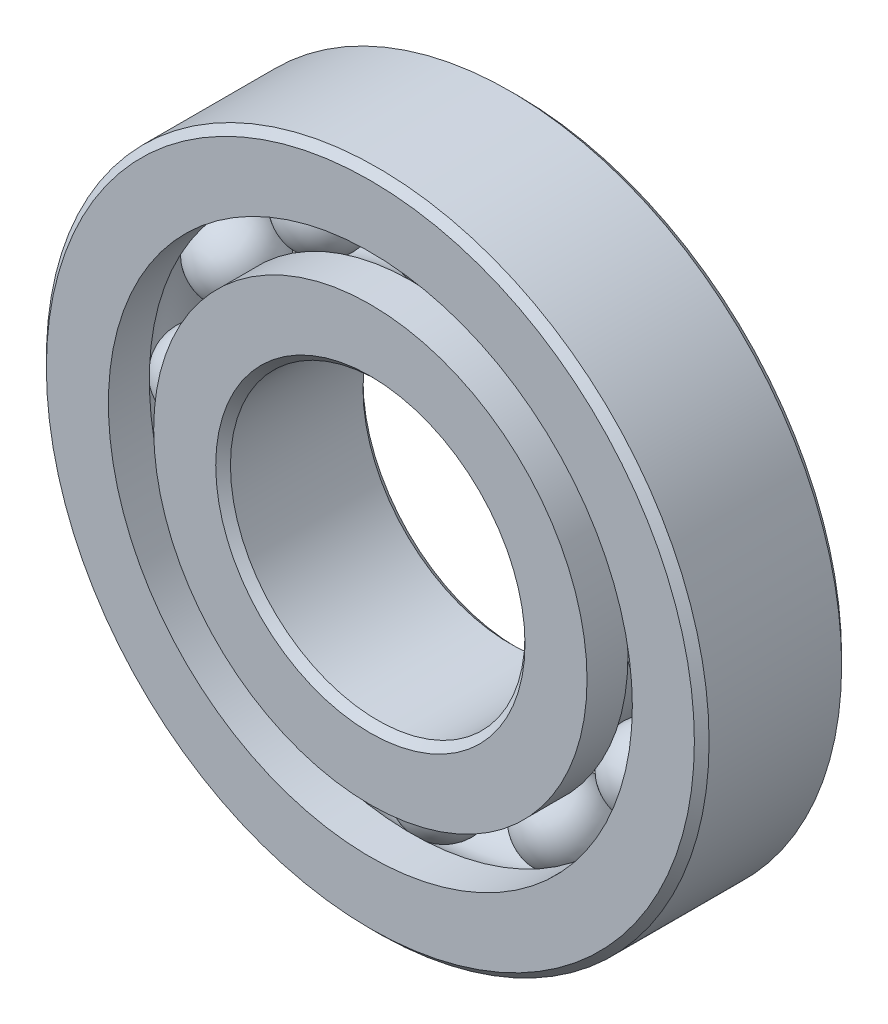
from build123d import *

# Parameters (mm, degrees)
CIRPATTERN1_COUNT = 12


with BuildPart() as part:
    # Sketch1 → Revolve1 (revolve)
    with BuildSketch(Plane(origin=(0, 0, 0), x_dir=(0, 0, -1), z_dir=(1, 0, 0)), mode=Mode.PRIVATE) as revolve1_sk:
        with BuildLine():
            Line((2.8575, 14.2875), (-2.8575, 14.2875))
            Line((-2.8575, 14.2875), (-3.175, 13.97))
            Line((-3.175, 13.97), (-3.175, 11.295673077))
            Line((-3.175, 11.295673077), (-1.411111111, 11.295673077))
            ThreePointArc((-1.411111111, 11.295673077), (0, 12.035028901), (1.411111111, 11.295673077))
            Line((1.411111111, 11.295673077), (3.175, 11.295673077))
            Line((3.175, 11.295673077), (3.175, 13.97))
            Line((3.175, 13.97), (2.8575, 14.2875))
        make_face()
    revolve(revolve1_sk.sketch.rotate(Axis((0, 0, 3.175), (0, 0, -1)), 90), axis=Axis((0, 0, 3.175), (0, 0, -1)))


with BuildPart() as body_2:
    # Sketch3 → Revolve3 (revolve)
    with BuildSketch(Plane(origin=(0, 0, 0), x_dir=(0, 0, -1), z_dir=(1, 0, 0)), mode=Mode.PRIVATE) as revolve3_sk:
        with BuildLine():
            Line((-3.175, 9.341826923), (-1.411111111, 9.341826923))
            ThreePointArc((-1.411111111, 9.341826923), (0, 8.602471099), (1.411111111, 9.341826923))
            Line((1.411111111, 9.341826923), (3.175, 9.341826923))
            Line((3.175, 9.341826923), (3.175, 6.6675))
            Line((3.175, 6.6675), (2.8575, 6.35))
            Line((2.8575, 6.35), (-2.8575, 6.35))
            Line((-2.8575, 6.35), (-3.175, 6.6675))
            Line((-3.175, 6.6675), (-3.175, 9.341826923))
        make_face()
    revolve(revolve3_sk.sketch.rotate(Axis((0, 0, 3.175), (0, 0, -1)), 90), axis=Axis((0, 0, 3.175), (0, 0, -1)))


with BuildPart() as body_3:
    # Sketch4 → Revolve4 (revolve)
    with BuildSketch(Plane(origin=(0, 0, 0), x_dir=(0, 0, -1), z_dir=(1, 0, 0))):
        with BuildLine():
            Line((-1.716278901, 10.31875), (1.716278901, 10.31875))
            ThreePointArc((1.716278901, 10.31875), (0, 12.035028901), (-1.716278901, 10.31875))
        make_face()
    revolve(axis=Axis((0, 10.31875, 1.716278901), (0, 0, -1)))


with BuildPart() as cirpattern1_1:
    # CirPattern1: pattern copy
    add(body_3.part.rotate(Axis((0, 0, 0), (0, 0, 1)), 1 * 360 / CIRPATTERN1_COUNT))


with BuildPart() as cirpattern1_2:
    # CirPattern1: pattern copy
    add(body_3.part.rotate(Axis((0, 0, 0), (0, 0, 1)), 2 * 360 / CIRPATTERN1_COUNT))


with BuildPart() as cirpattern1_3:
    # CirPattern1: pattern copy
    add(body_3.part.rotate(Axis((0, 0, 0), (0, 0, 1)), 3 * 360 / CIRPATTERN1_COUNT))


with BuildPart() as cirpattern1_4:
    # CirPattern1: pattern copy
    add(body_3.part.rotate(Axis((0, 0, 0), (0, 0, 1)), 4 * 360 / CIRPATTERN1_COUNT))


with BuildPart() as cirpattern1_5:
    # CirPattern1: pattern copy
    add(body_3.part.rotate(Axis((0, 0, 0), (0, 0, 1)), 5 * 360 / CIRPATTERN1_COUNT))


with BuildPart() as cirpattern1_6:
    # CirPattern1: pattern copy
    add(body_3.part.rotate(Axis((0, 0, 0), (0, 0, 1)), 6 * 360 / CIRPATTERN1_COUNT))


with BuildPart() as cirpattern1_7:
    # CirPattern1: pattern copy
    add(body_3.part.rotate(Axis((0, 0, 0), (0, 0, 1)), 7 * 360 / CIRPATTERN1_COUNT))


with BuildPart() as cirpattern1_8:
    # CirPattern1: pattern copy
    add(body_3.part.rotate(Axis((0, 0, 0), (0, 0, 1)), 8 * 360 / CIRPATTERN1_COUNT))


with BuildPart() as cirpattern1_9:
    # CirPattern1: pattern copy
    add(body_3.part.rotate(Axis((0, 0, 0), (0, 0, 1)), 9 * 360 / CIRPATTERN1_COUNT))


with BuildPart() as cirpattern1_10:
    # CirPattern1: pattern copy
    add(body_3.part.rotate(Axis((0, 0, 0), (0, 0, 1)), 10 * 360 / CIRPATTERN1_COUNT))


with BuildPart() as cirpattern1_11:
    # CirPattern1: pattern copy
    add(body_3.part.rotate(Axis((0, 0, 0), (0, 0, 1)), 11 * 360 / CIRPATTERN1_COUNT))


solid = Compound([part.part, body_2.part, body_3.part, cirpattern1_1.part, cirpattern1_2.part, cirpattern1_3.part, cirpattern1_4.part, cirpattern1_5.part, cirpattern1_6.part, cirpattern1_7.part, cirpattern1_8.part, cirpattern1_9.part, cirpattern1_10.part, cirpattern1_11.part])
